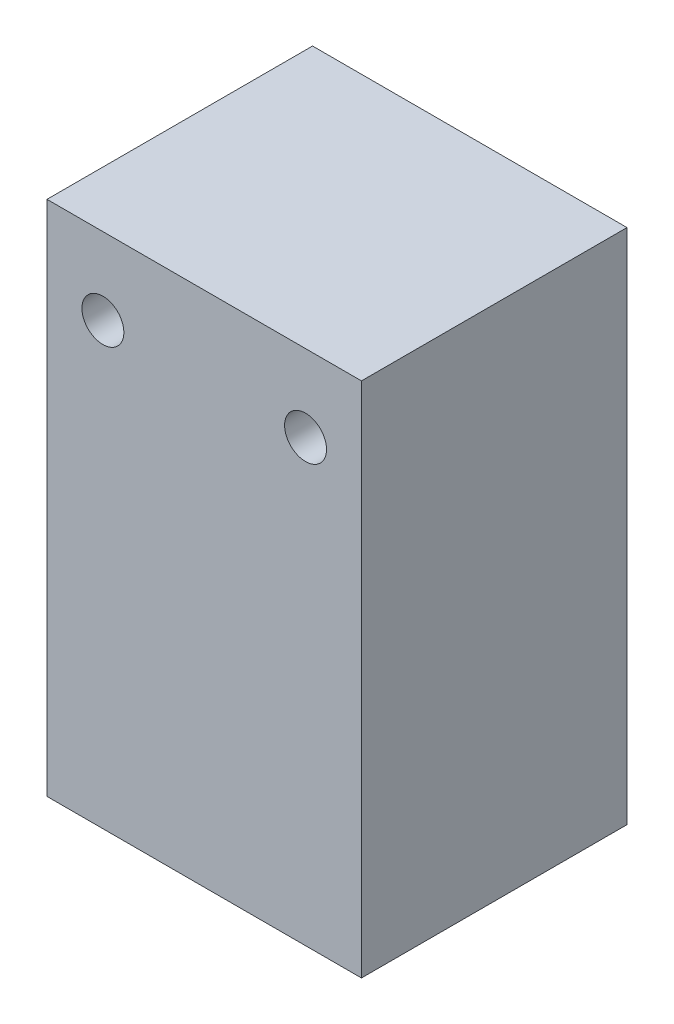
from build123d import *

# Parameters (mm, degrees)
SKETCH1_W               = 22.5
SKETCH1_H               = 37
SKETCH1_R               = 1.5
BOSS_EXTRUDE1_DEPTH     = 19
BOSS_EXTRUDE2_DEPTH     = 8
SKETCH2_W               = 5.15
SKETCH2_H               = 2.7
BOSS_EXTRUDE3_DEPTH     = 4.8
CUT_EXTRUDE1_DEPTH      = 47.217664372
CUT_EXTRUDE1_DEPTH_BACK = 47.217664372
SKETCH3_R               = 1.5


with BuildPart() as part:
    # Sketch1 → Boss-Extrude1 (new body)
    with BuildSketch(Plane.XY):
        with Locations((-11.25, 18.5)):
            Rectangle(SKETCH1_W, SKETCH1_H)
        with Locations((-18.5, 31.5)):
            Circle(SKETCH1_R, mode=Mode.SUBTRACT)
        with Locations((-4, 31.5)):
            Circle(SKETCH1_R, mode=Mode.SUBTRACT)
    extrude(amount=BOSS_EXTRUDE1_DEPTH)

    # Sketch1<3> → Boss-Extrude2 (add)
    with BuildSketch(Plane.XY):
        with BuildLine():
            ThreePointArc((-13.081517172, 12.4), (-13.9, 10.55), (-13.081517172, 8.7))
            Line((-13.081517172, 8.7), (-9.418482828, 8.7))
            ThreePointArc((-9.418482828, 8.7), (-8.6, 10.55), (-9.418482828, 12.4))
            Line((-9.418482828, 12.4), (-13.081517172, 12.4))
        make_face()
    extrude(amount=-BOSS_EXTRUDE2_DEPTH)

    # Sketch2 → Boss-Extrude3 (add)
    with BuildSketch(Plane.XZ):
        with Locations((-11.25, 9.5)):
            Rectangle(SKETCH2_W, SKETCH2_H)
    extrude(amount=BOSS_EXTRUDE3_DEPTH)

    # Sketch3 → Cut-Extrude1 (cut, two sides: drawn at the far end of the back side and taken through both)
    with BuildSketch(Plane(origin=(0, 0, 8.15), x_dir=(-1, 0, 0), z_dir=(0, 0, -1)).offset(-CUT_EXTRUDE1_DEPTH_BACK)):
        with Locations((11.25, -2.4)):
            Circle(SKETCH3_R)
    extrude(amount=CUT_EXTRUDE1_DEPTH + CUT_EXTRUDE1_DEPTH_BACK, mode=Mode.SUBTRACT)


solid = part.part
